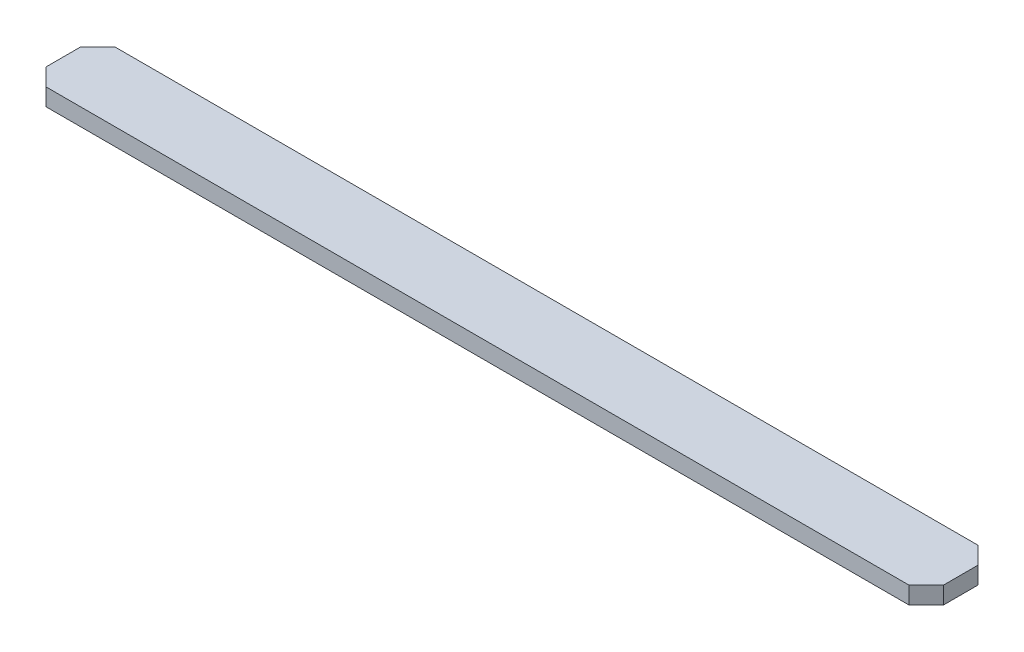
from build123d import *

# Parameters (mm, degrees)
SKETCH1_W           = 52
SKETCH1_H           = 4
BOSS_EXTRUDE1_DEPTH = 1
CHAMFER1_SIZE       = 1


with BuildPart() as part:
    # Sketch1 → Boss-Extrude1 (new body)
    with BuildSketch(Plane(origin=(0, 0, 0), x_dir=(1, 0, 0), z_dir=(0, 1, 0))):
        Rectangle(SKETCH1_W, SKETCH1_H)
    extrude(amount=BOSS_EXTRUDE1_DEPTH)

    # Chamfer1
    chamfer1_edges = [part.edges().sort_by_distance(p)[0] for p in [
        (26, 0.5, 2),
        (-26, 0.5, 2),
        (-26, 0.5, -2),
        (26, 0.5, -2),
    ]]
    chamfer(chamfer1_edges, length=CHAMFER1_SIZE)


solid = part.part
